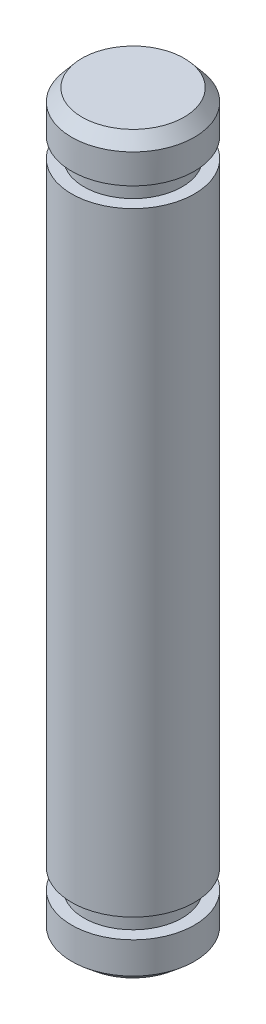
from build123d import *
from OCP.BRepFilletAPI import BRepFilletAPI_MakeChamfer

# Parameters (mm, degrees)
SKETCH_1_R          = 2.5
EXTRUDE_1_DEPTH     = 15
SKETCH_2_R          = 2.5
SKETCH_2_R_2        = 2
CUT_EXTRUDE_1_DEPTH = 0.8
CHAMFER_1_SIZE      = 0.5
CHAMFER_1_SIZE2     = 0.419549816


with BuildPart() as part:
    # 草图1 → 凸台-拉伸1 (new body)
    with BuildSketch(Plane(origin=(0, 0, 0), x_dir=(1, 0, 0), z_dir=(0, 1, 0))):
        with Locations(Location((0, 0, 0), (0, 0, 270))):
            Circle(SKETCH_1_R)
    extrude_1 = extrude(amount=EXTRUDE_1_DEPTH)

    # 草图2 → 切除-拉伸1 (cut)
    with BuildSketch(Plane(origin=(0, 12.5, 0), x_dir=(-1, 0, 0), z_dir=(0, -1, 0))):
        with Locations(Location((0, 0, 0), (0, 0, 90))):
            Circle(SKETCH_2_R)
        with Locations(Location((0, 0, 0), (0, 0, 90))):
            Circle(SKETCH_2_R_2, mode=Mode.SUBTRACT)
    cut_extrude_1 = extrude(amount=-CUT_EXTRUDE_1_DEPTH, mode=Mode.SUBTRACT)

    # 镜向1: 凸台-拉伸1, 切除-拉伸1 across plane
    add(extrude_1.mirror(Plane.ZX))
    add(cut_extrude_1.mirror(Plane.ZX), mode=Mode.SUBTRACT)

    # 倒角1: one chamfer whose edges measure the first distance from different faces: ONE call of the kernel's chamfer builder (chamfer() names one face for all edges)
    chamfer_1_edges_1 = [part.edges().sort_by_distance(p)[0] for p in [
        (0, -15, -2.5),
    ]]
    chamfer_1_side_1 = [part.faces().sort_by_distance(p)[0] for p in [
        (0, -15, 0),
    ]]
    chamfer_1_edges_2 = [part.edges().sort_by_distance(p)[0] for p in [
        (0, 15, -2.5),
    ]]
    chamfer_1_side_2 = [part.faces().sort_by_distance(p)[0] for p in [
        (0, 14.15, -2.5),
    ]]
    chamfer_1 = BRepFilletAPI_MakeChamfer(part.part.solid().wrapped)
    for e in chamfer_1_edges_1:
        chamfer_1.Add(CHAMFER_1_SIZE, CHAMFER_1_SIZE2, e.wrapped, chamfer_1_side_1[0].wrapped)  # the first distance lies on this face
    for e in chamfer_1_edges_2:
        chamfer_1.Add(CHAMFER_1_SIZE, CHAMFER_1_SIZE2, e.wrapped, chamfer_1_side_2[0].wrapped)  # the first distance lies on this face
    add(Compound.cast(chamfer_1.Shape()), mode=Mode.REPLACE)


solid = part.part
